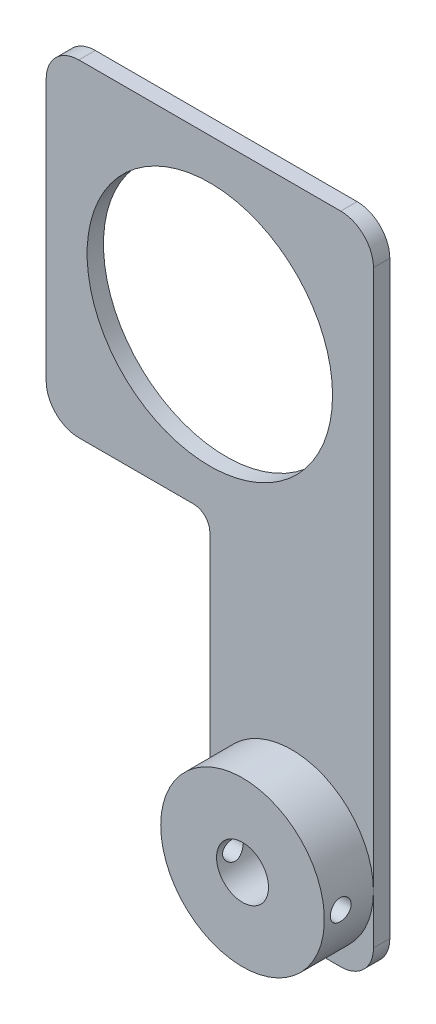
from build123d import *

# Parameters (mm, degrees)
CROQUIS1_R              = 37.5
SALIENTE_EXTRUIR1_DEPTH = 5
CROQUIS2_R              = 25
CROQUIS2_R_2            = 7.9375
SALIENTE_EXTRUIR2_DEPTH = 20
CROQUIS3_R              = 3.175
CORTAR_EXTRUIR2_DEPTH   = 65


with BuildPart() as part:
    # Croquis1 → Saliente-Extruir1 (new body)
    with BuildSketch(Plane.XY):
        with BuildLine():
            Line((-5, 0), (-40, 0))
            ThreePointArc((-40, 0), (-47.071067812, 2.928932188), (-50, 10))
            Line((-50, 10), (-50, 90))
            ThreePointArc((-50, 90), (-47.071067812, 97.071067812), (-40, 100))
            Line((-40, 100), (40, 100))
            ThreePointArc((40, 100), (47.071067812, 97.071067812), (50, 90))
            Line((50, 90), (50, -90))
            ThreePointArc((50, -90), (47.071067812, -97.071067812), (40, -100))
            Line((40, -100), (10, -100))
            ThreePointArc((10, -100), (2.928932188, -97.071067812), (0, -90))
            Line((0, -90), (0, -5))
            ThreePointArc((0, -5), (-1.464466094, -1.464466094), (-5, 0))
        make_face()
        with Locations((0, 50)):
            Circle(CROQUIS1_R, mode=Mode.SUBTRACT)
    extrude(amount=SALIENTE_EXTRUIR1_DEPTH)

    # Croquis2 → Saliente-Extruir2 (add)
    with BuildSketch(Plane(origin=(0, 0, 0), x_dir=(-1, 0, 0), z_dir=(0, 0, -1))):
        with Locations((-25, -75)):
            Circle(CROQUIS2_R)
        with Locations((-25, -75)):
            Circle(CROQUIS2_R_2, mode=Mode.SUBTRACT)
    extrude(amount=-SALIENTE_EXTRUIR2_DEPTH)

    # Croquis3 → Cortar-Extruir2 (cut)
    with BuildSketch(Plane(origin=(0, 0, 0), x_dir=(0, 0, -1), z_dir=(1, 0, 0))):
        with Locations((10, -75)):
            Circle(CROQUIS3_R)
        with Locations(Location((-15, -75, 0), (0, 0, 180))):
            Circle(CROQUIS3_R)
    extrude(amount=CORTAR_EXTRUIR2_DEPTH, mode=Mode.SUBTRACT)


solid = part.part
